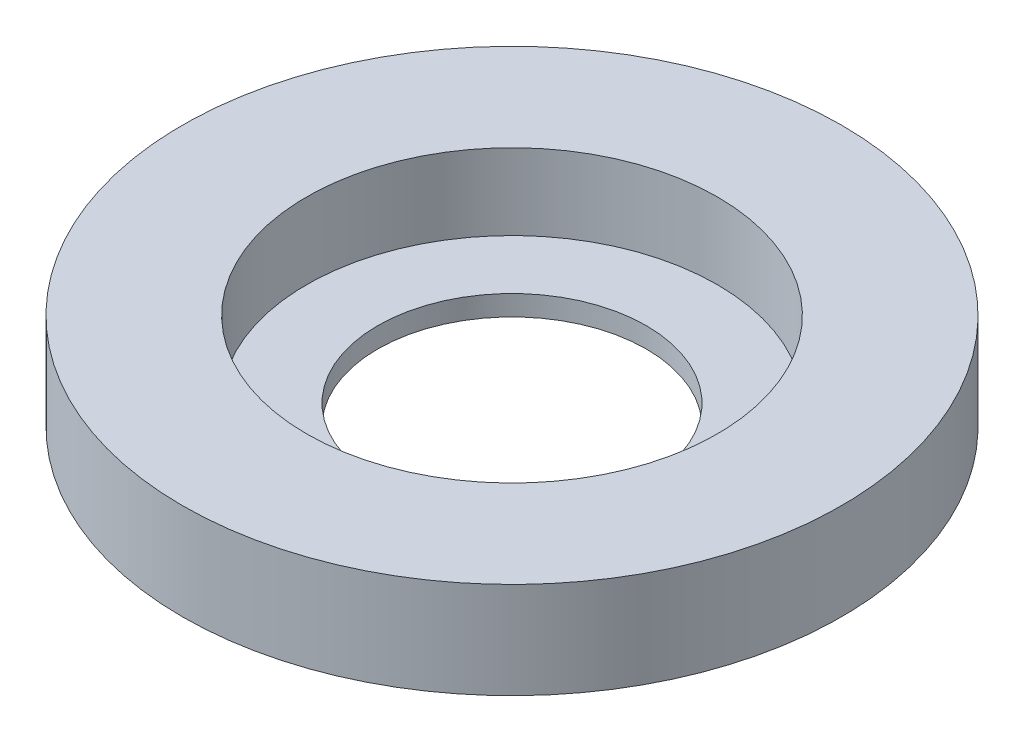
from build123d import *


with BuildPart() as part:
    # Sketch1 → Revolve1 (revolve)
    with BuildSketch(Plane.XY, mode=Mode.PRIVATE) as revolve1_sk:
        Polygon((5.3, 0), (13, 0), (13, 3.8), (8.1, 3.8), (8.1, 0.8), (5.3, 0.8), align=None)
    revolve(revolve1_sk.sketch.rotate(Axis((0, 0, 0), (0, 1, 0)), 90), axis=Axis((0, 0, 0), (0, 1, 0)))


solid = part.part
